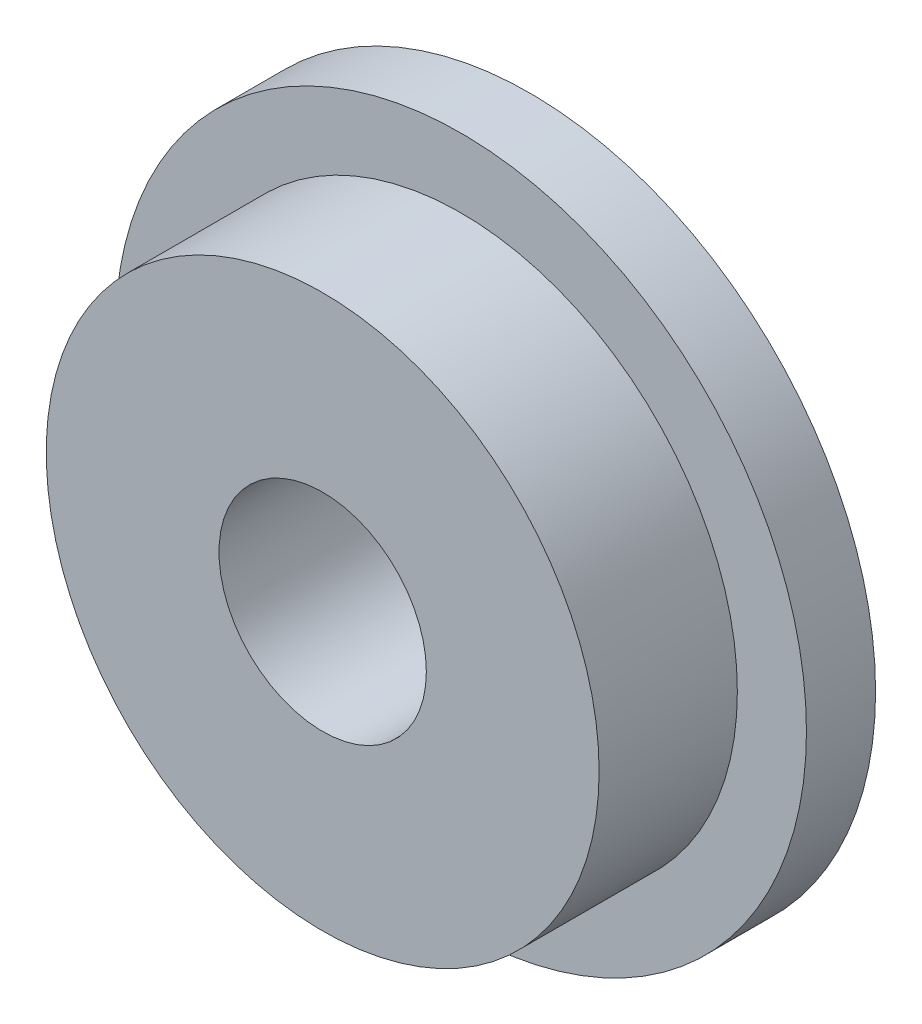
from build123d import *

# Parameters (mm, degrees)
SKETCH_1_R          = 5
SKETCH_1_R_2        = 1.5
EXTRUDE_1_DEPTH     = 1
SKETCH_2_R          = 4
EXTRUDE_2_DEPTH     = 2
SKETCH_3_R          = 1.5
CUT_EXTRUDE_1_DEPTH = 8.681145748


with BuildPart() as part:
    # 스케치1 → 돌출1 (new body)
    with BuildSketch(Plane.XY):
        Circle(SKETCH_1_R)
        Circle(SKETCH_1_R_2, mode=Mode.SUBTRACT)
    extrude(amount=EXTRUDE_1_DEPTH)

    # 스케치2 → 돌출2 (add)
    with BuildSketch(Plane.XY.offset(1)):
        Circle(SKETCH_2_R)
    extrude(amount=EXTRUDE_2_DEPTH)

    # 스케치3 → 컷-돌출1 (cut, through all)
    with BuildSketch(Plane.XY.offset(3)):
        Circle(SKETCH_3_R)
    extrude(amount=-CUT_EXTRUDE_1_DEPTH, mode=Mode.SUBTRACT)


solid = part.part
